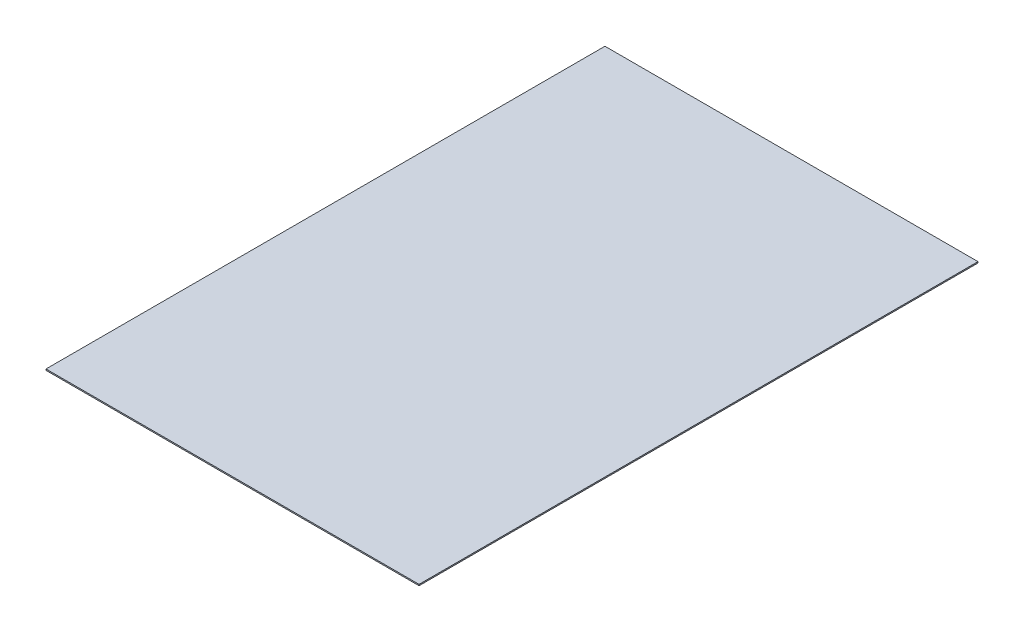
from build123d import *

# Parameters (mm, degrees)
SKETCH1_W           = 76.2
SKETCH1_H           = 114.173
BOSS_EXTRUDE1_DEPTH = 0.254


with BuildPart() as part:
    # Sketch1 → Boss-Extrude1 (new body)
    with BuildSketch(Plane(origin=(0, 0, 0), x_dir=(1, 0, 0), z_dir=(0, 1, 0))):
        with Locations((38.1, 57.0865)):
            Rectangle(SKETCH1_W, SKETCH1_H)
    extrude(amount=BOSS_EXTRUDE1_DEPTH)


solid = part.part
